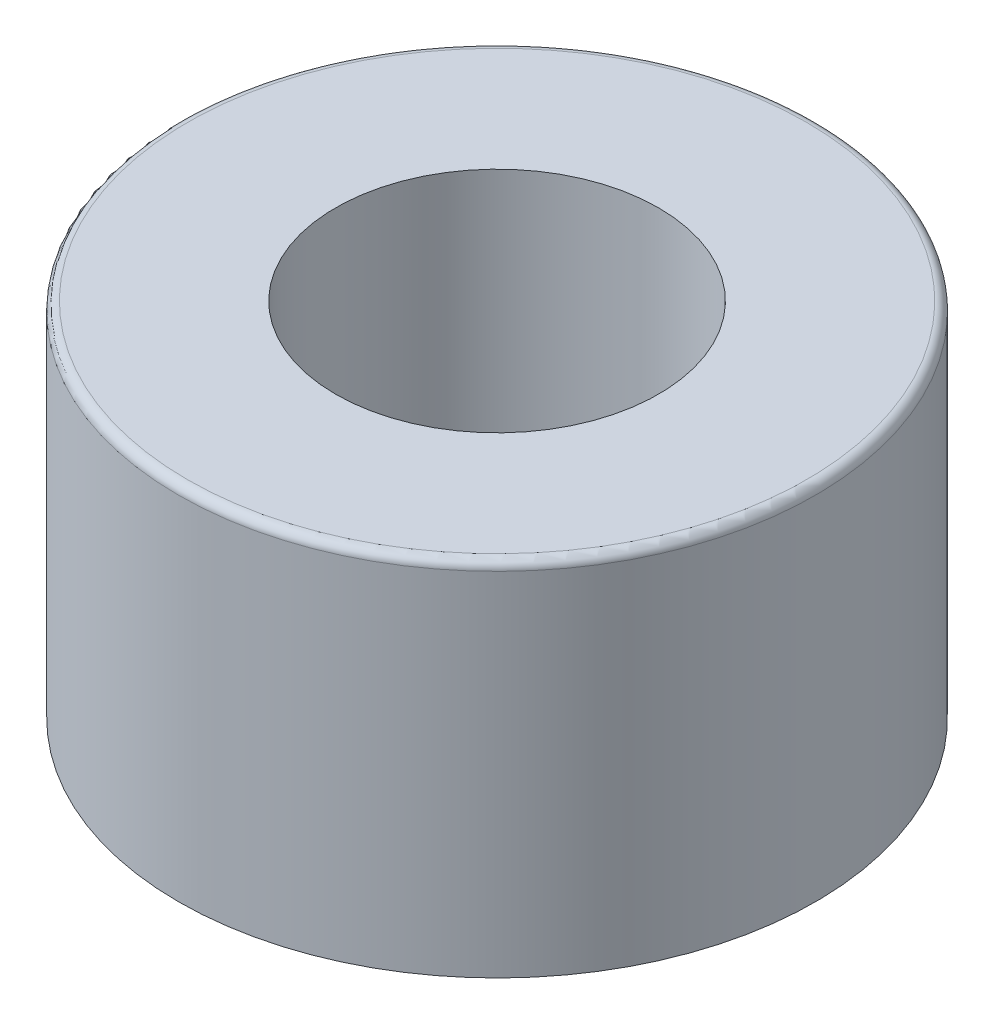
from build123d import *

# Parameters (mm, degrees)
SKETCH1_R           = 9.017
SKETCH1_R_2         = 4.572
BOSS_EXTRUDE1_DEPTH = 10.2235
FILLET2_R           = 0.254


with BuildPart() as part:
    # Sketch1 → Boss-Extrude1 (new body)
    with BuildSketch(Plane(origin=(0, 0, 0), x_dir=(1, 0, 0), z_dir=(0, 1, 0))):
        with Locations(Location((0, 0, 0), (0, 0, 270))):
            Circle(SKETCH1_R)
        with Locations(Location((0, 0, 0), (0, 0, 270))):
            Circle(SKETCH1_R_2, mode=Mode.SUBTRACT)
    extrude(amount=BOSS_EXTRUDE1_DEPTH)

    # Fillet2
    fillet2_edges = [part.edges().sort_by_distance(p)[0] for p in [
        (0, 10.2235, -9.017),
    ]]
    fillet(fillet2_edges, radius=FILLET2_R)


solid = part.part
